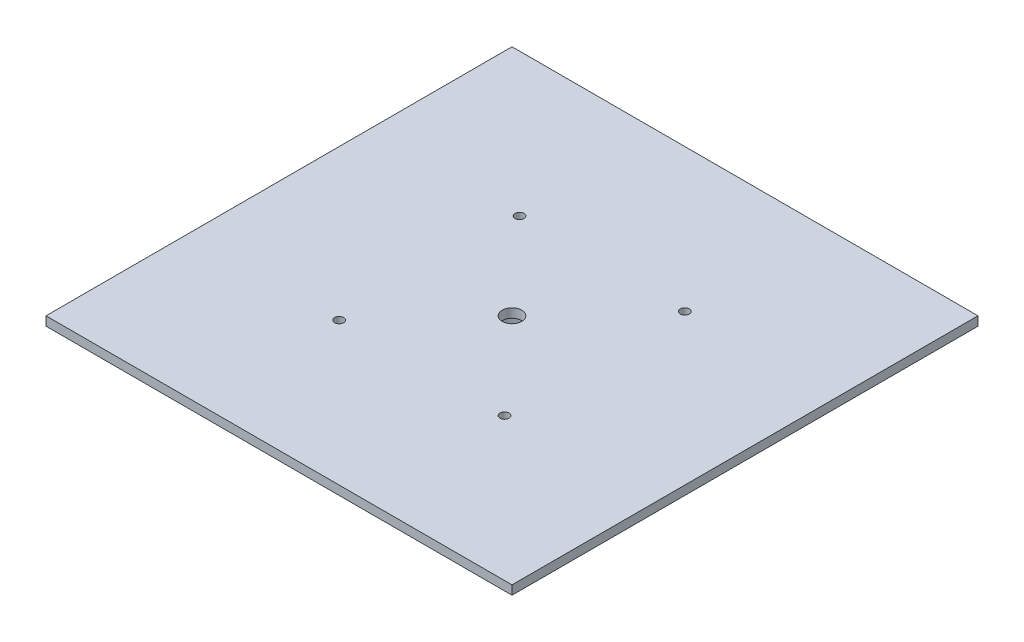
from build123d import *

# Parameters (mm, degrees)
SKETCH10_W          = 155
SKETCH10_H          = 155
BOSS_EXTRUDE3_DEPTH = 3
SKETCH11_R          = 17.5
SKETCH11_R_2        = 12.59
BOSS_EXTRUDE4_DEPTH = 8.4
SKETCH11_4_R        = 2.3
BOSS_EXTRUDE6_DEPTH = 4
SKETCH12_R          = 2.55
CUT_EXTRUDE1_DEPTH  = 37
SKETCH14_R          = 2.55
CUT_EXTRUDE2_DEPTH  = 75
SKETCH15_R          = 1.5
SKETCH15_R_2        = 3.25
CUT_EXTRUDE3_DEPTH  = 95


with BuildPart() as part:
    # Sketch10 → Boss-Extrude3 (new body)
    with BuildSketch(Plane.XZ):
        with Locations((-75.370825338, 0)):
            Rectangle(SKETCH10_W, SKETCH10_H)
    extrude(amount=BOSS_EXTRUDE3_DEPTH)

    # Sketch11 → Boss-Extrude4 (add)
    with BuildSketch(Plane.XZ.offset(3)):
        with Locations((-75.370825338, 0)):
            Circle(SKETCH11_R)
        with Locations((-75.370825338, 0)):
            Circle(SKETCH11_R_2, mode=Mode.SUBTRACT)
    extrude(amount=BOSS_EXTRUDE4_DEPTH)

    # Sketch11<4> → Boss-Extrude6 (add)
    with BuildSketch(Plane.XZ.offset(3)):
        with Locations((-135.260825338, 59.89)):
            Circle(SKETCH11_4_R)
        with Locations((-15.480825338, 59.89)):
            Circle(SKETCH11_4_R)
        with Locations((-15.480825338, -59.89)):
            Circle(SKETCH11_4_R)
        with Locations((-135.260825338, -59.89)):
            Circle(SKETCH11_4_R)
    extrude(amount=BOSS_EXTRUDE6_DEPTH)

    # Sketch12 → Cut-Extrude1 (cut)
    with BuildSketch(Plane.XY):
        with Locations((-75.370825338, -6.9)):
            Circle(SKETCH12_R)
    extrude(amount=-CUT_EXTRUDE1_DEPTH, mode=Mode.SUBTRACT)

    # Sketch14 → Cut-Extrude2 (cut)
    with BuildSketch(Plane(origin=(0, 0, 0), x_dir=(0, 0, -1), z_dir=(1, 0, 0))):
        with Locations((0, -6.9)):
            Circle(SKETCH14_R)
    extrude(amount=-CUT_EXTRUDE2_DEPTH, mode=Mode.SUBTRACT)

    # Sketch15 → Cut-Extrude3 (cut)
    with BuildSketch(Plane(origin=(0, 0, 0), x_dir=(1, 0, 0), z_dir=(0, 1, 0))):
        with Locations((-102.870825338, 30)):
            Circle(SKETCH15_R)
        with Locations((-47.870825338, 30)):
            Circle(SKETCH15_R)
        with Locations((-47.870825338, -30)):
            Circle(SKETCH15_R)
        with Locations((-102.870825338, -30)):
            Circle(SKETCH15_R)
        with Locations((-75.370825338, 0)):
            Circle(SKETCH15_R_2)
    extrude(amount=-CUT_EXTRUDE3_DEPTH, mode=Mode.SUBTRACT)


solid = part.part
